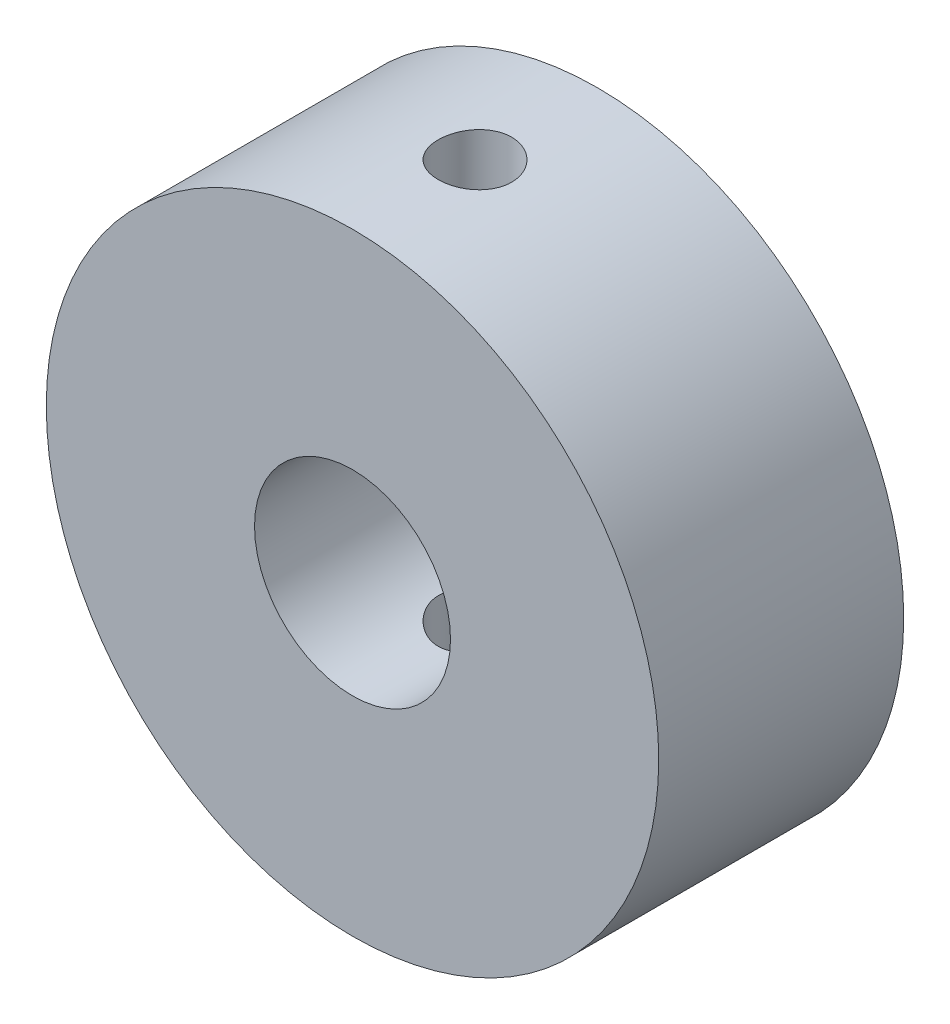
from build123d import *

# Parameters (mm, degrees)
SKETCH1_R               = 12.5
SKETCH1_R_2             = 4
BOSS_EXTRUDE1_DEPTH     = 5
CUT_EXTRUDE1_DEPTH      = 14
CUT_EXTRUDE1_DEPTH_BACK = 17
SKETCH2_R               = 1.5


with BuildPart() as part:
    # Sketch1 → Boss-Extrude1 (new, symmetric)
    with BuildSketch(Plane.XY):
        Circle(SKETCH1_R)
        Circle(SKETCH1_R_2, mode=Mode.SUBTRACT)
    extrude(amount=BOSS_EXTRUDE1_DEPTH, both=True)

    # Sketch2 → Cut-Extrude1 (cut, two sides: drawn at the far end of the back side and taken through both)
    with BuildSketch(Plane(origin=(0, 0, 0), x_dir=(1, 0, 0), z_dir=(0, 1, 0)).offset(-CUT_EXTRUDE1_DEPTH_BACK)):
        with Locations(Location((0, 0, 0), (0, 0, 90))):
            Circle(SKETCH2_R)
    extrude(amount=CUT_EXTRUDE1_DEPTH + CUT_EXTRUDE1_DEPTH_BACK, mode=Mode.SUBTRACT)


solid = part.part
